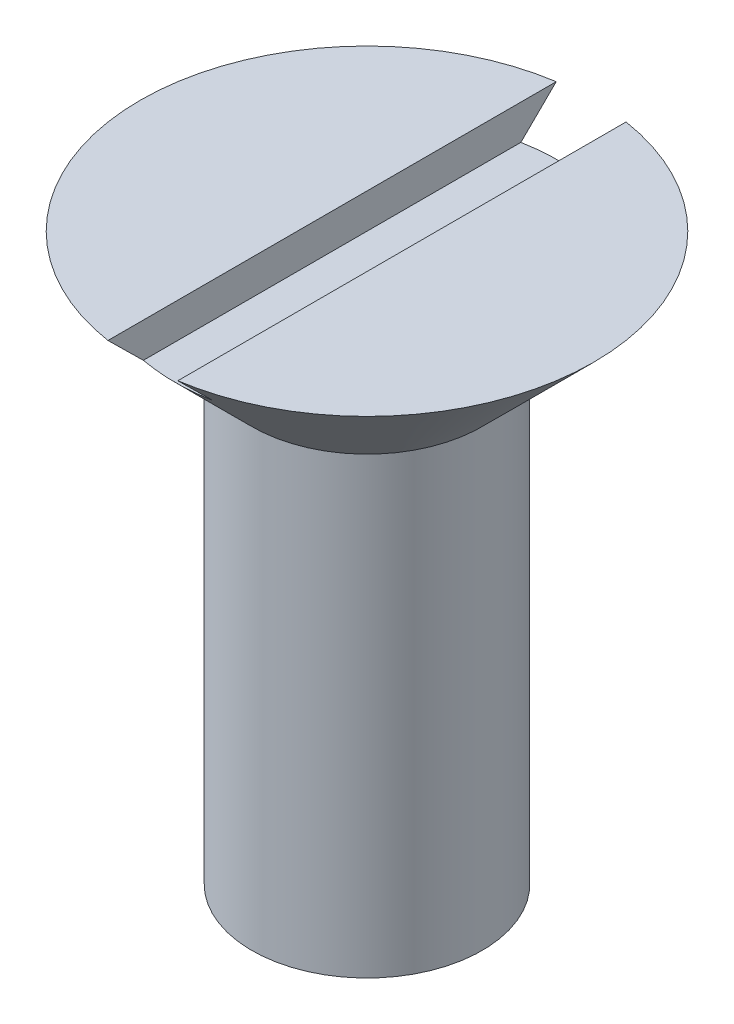
from build123d import *

# Parameters (mm, degrees)
CUT_EXTRUDE1_DEPTH      = 21.305178915
CUT_EXTRUDE1_DEPTH_BACK = 21.305178915
SKETCH2_W               = 2
SKETCH2_H               = 1


with BuildPart() as part:
    # Sketch1 → Revolve1 (revolve)
    with BuildSketch(Plane.XY):
        Polygon((-6.5, 0), (-3.3, -3.2), (-3.3, -16.2), (0, -18.105255888), (0, 0), align=None)
    revolve(axis=Axis((0, 0, 0), (0, -1, 0)))

    # Sketch2 → Cut-Extrude1 (cut, two sides: drawn at the far end of the back side and taken through both)
    with BuildSketch(Plane.XY.offset(-CUT_EXTRUDE1_DEPTH_BACK)):
        with Locations((0, -0.5)):
            Rectangle(SKETCH2_W, SKETCH2_H)
    extrude(amount=CUT_EXTRUDE1_DEPTH + CUT_EXTRUDE1_DEPTH_BACK, mode=Mode.SUBTRACT)


solid = part.part
